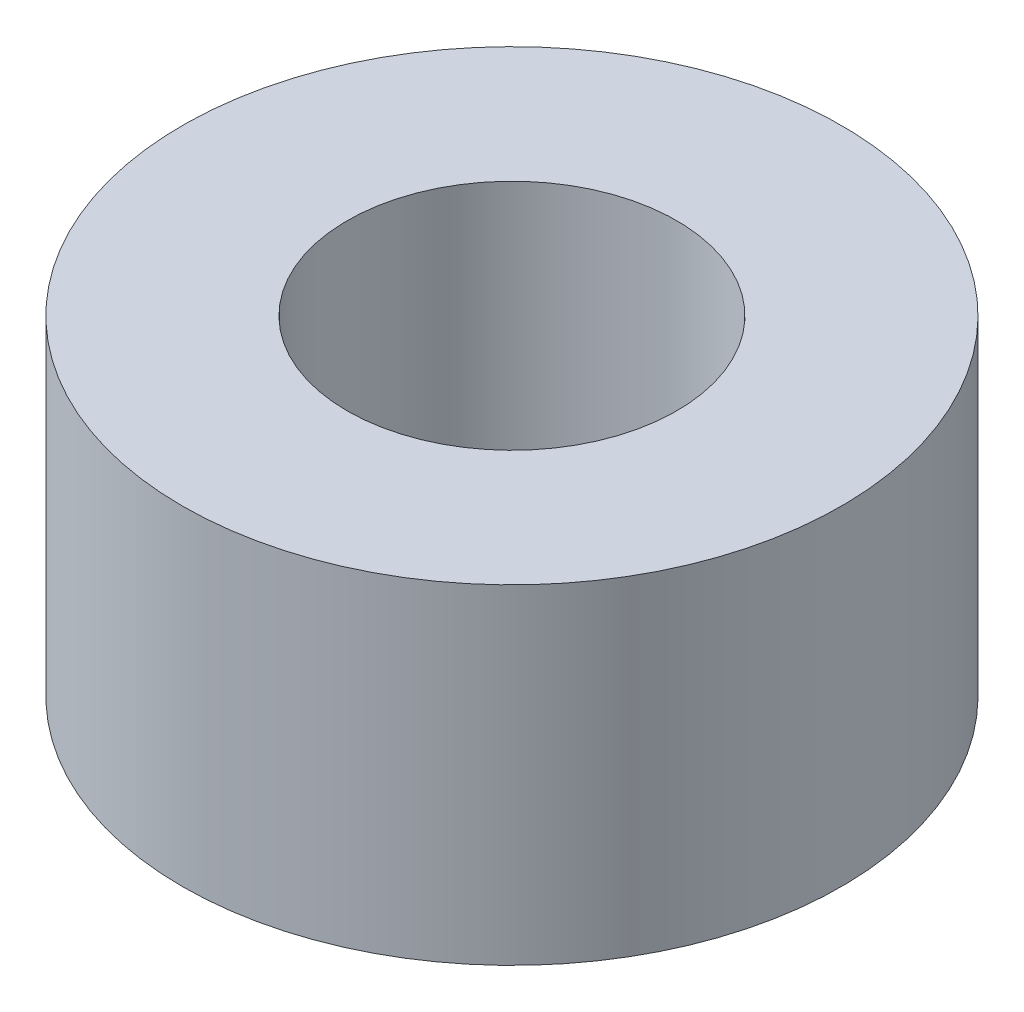
from build123d import *

# Parameters (mm, degrees)
SKETCH1_R           = 3
SKETCH1_R_2         = 1.5
BOSS_EXTRUDE1_DEPTH = 3


with BuildPart() as part:
    # Sketch1 → Boss-Extrude1 (new body)
    with BuildSketch(Plane(origin=(0, 0, 0), x_dir=(1, 0, 0), z_dir=(0, 1, 0))):
        with Locations(Location((0, 0, 0), (0, 0, 270))):
            Circle(SKETCH1_R)
        with Locations(Location((0, 0, 0), (0, 0, 270))):
            Circle(SKETCH1_R_2, mode=Mode.SUBTRACT)
    extrude(amount=BOSS_EXTRUDE1_DEPTH)


solid = part.part
